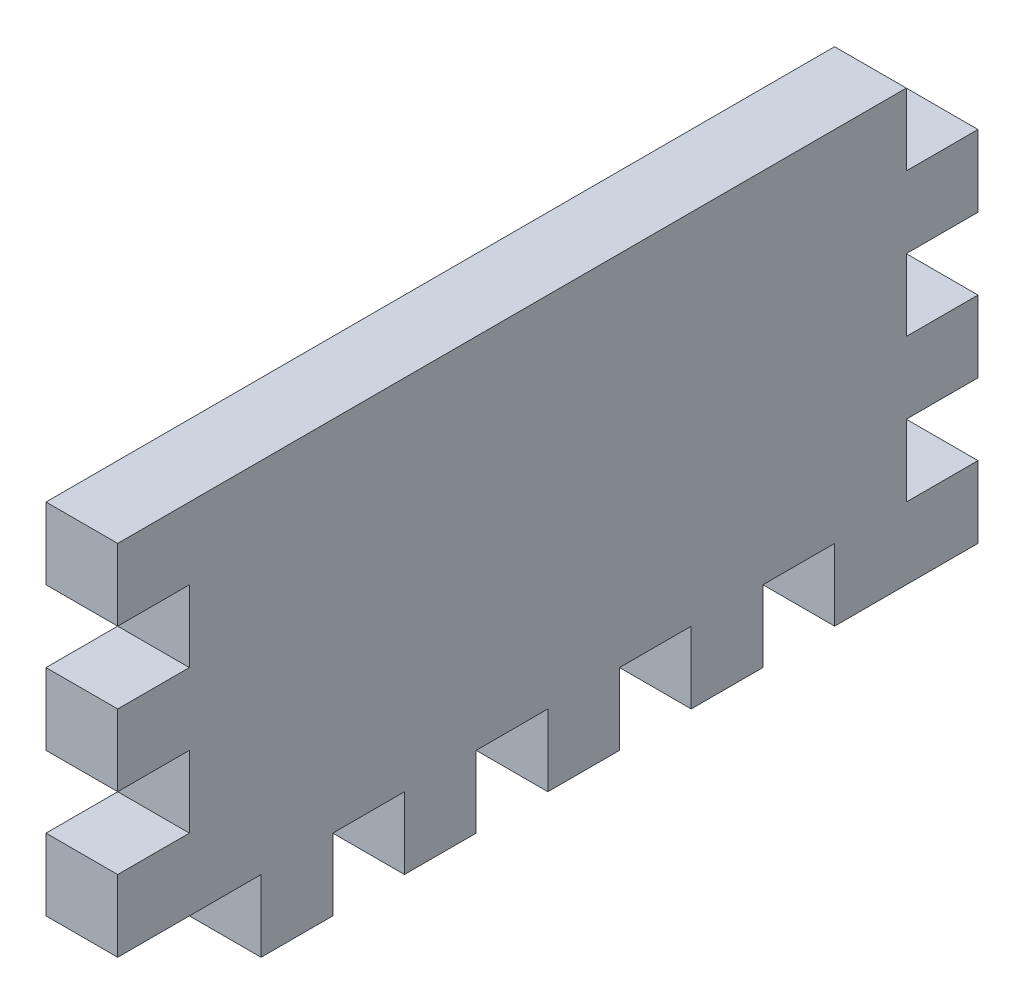
from build123d import *

# Parameters (mm, degrees)
SKETCH1_W           = 152.4
SKETCH1_H           = 76.2
BOSS_EXTRUDE1_DEPTH = 12.7
SKETCH2_W           = 12.7
SKETCH2_H           = 12.7
CUT_EXTRUDE1_DEPTH  = 87.135590786
SKETCH3_W           = 12.7
SKETCH3_H           = 12.7
CUT_EXTRUDE2_DEPTH  = 12.7


with BuildPart() as part:
    # Sketch1 → Boss-Extrude1 (new body)
    with BuildSketch(Plane(origin=(0, 0, 0), x_dir=(0, 0, -1), z_dir=(1, 0, 0))):
        Rectangle(SKETCH1_W, SKETCH1_H)
    extrude(amount=BOSS_EXTRUDE1_DEPTH)

    # Sketch2 → Cut-Extrude1 (cut, through all)
    with BuildSketch(Plane(origin=(12.7, 0, 0), x_dir=(0, 0, -1), z_dir=(1, 0, 0))):
        with Locations((-69.85, 19.05)):
            Rectangle(SKETCH2_W, SKETCH2_H)
        with Locations((-69.85, -6.35)):
            Rectangle(SKETCH2_W, SKETCH2_H)
        with Locations((-69.85, -31.75)):
            Rectangle(SKETCH2_W, SKETCH2_H)
        with Locations((69.85, 31.75)):
            Rectangle(SKETCH2_W, SKETCH2_H)
        with Locations((69.85, 6.35)):
            Rectangle(SKETCH2_W, SKETCH2_H)
        with Locations((69.85, -19.05)):
            Rectangle(SKETCH2_W, SKETCH2_H)
    extrude(amount=-CUT_EXTRUDE1_DEPTH, mode=Mode.SUBTRACT)

    # Sketch3 → Cut-Extrude2 (cut)
    with BuildSketch(Plane(origin=(90.45925552, -38.1, 56.334406979), x_dir=(0, 0, 1), z_dir=(0, -1, 0))):
        with Locations((-100.784406979, 84.10925552)):
            Rectangle(SKETCH3_W, SKETCH3_H)
        with Locations((-75.384406979, 84.10925552)):
            Rectangle(SKETCH3_W, SKETCH3_H)
        with Locations((-49.984406979, 84.10925552)):
            Rectangle(SKETCH3_W, SKETCH3_H)
        with Locations((-24.584406979, 84.10925552)):
            Rectangle(SKETCH3_W, SKETCH3_H)
        with Locations((0.815593021, 84.10925552)):
            Rectangle(SKETCH3_W, SKETCH3_H)
    extrude(amount=-CUT_EXTRUDE2_DEPTH, mode=Mode.SUBTRACT)


solid = part.part
